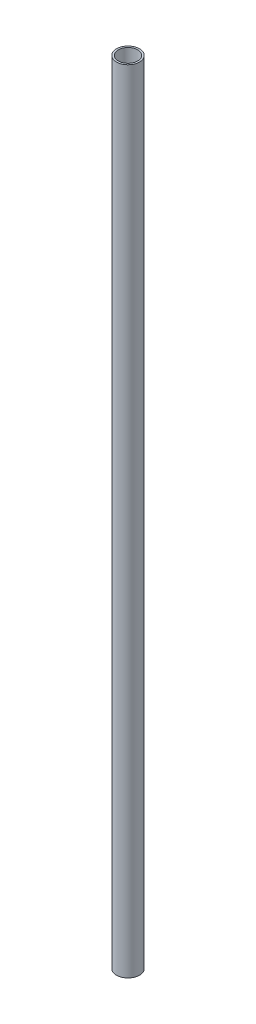
from build123d import *

# Parameters (mm, degrees)
SKETCH1_R           = 7.9375
SKETCH1_R_2         = 6.6929
BOSS_EXTRUDE1_DEPTH = 546.1


with BuildPart() as part:
    # Sketch1 → Boss-Extrude1 (new body)
    with BuildSketch(Plane(origin=(0, 0, 0), x_dir=(1, 0, 0), z_dir=(0, 1, 0))):
        with Locations(Location((0, 0, 0), (0, 0, 270))):
            Circle(SKETCH1_R)
        with Locations(Location((0, 0, 0), (0, 0, 270))):
            Circle(SKETCH1_R_2, mode=Mode.SUBTRACT)
    extrude(amount=BOSS_EXTRUDE1_DEPTH)


solid = part.part
